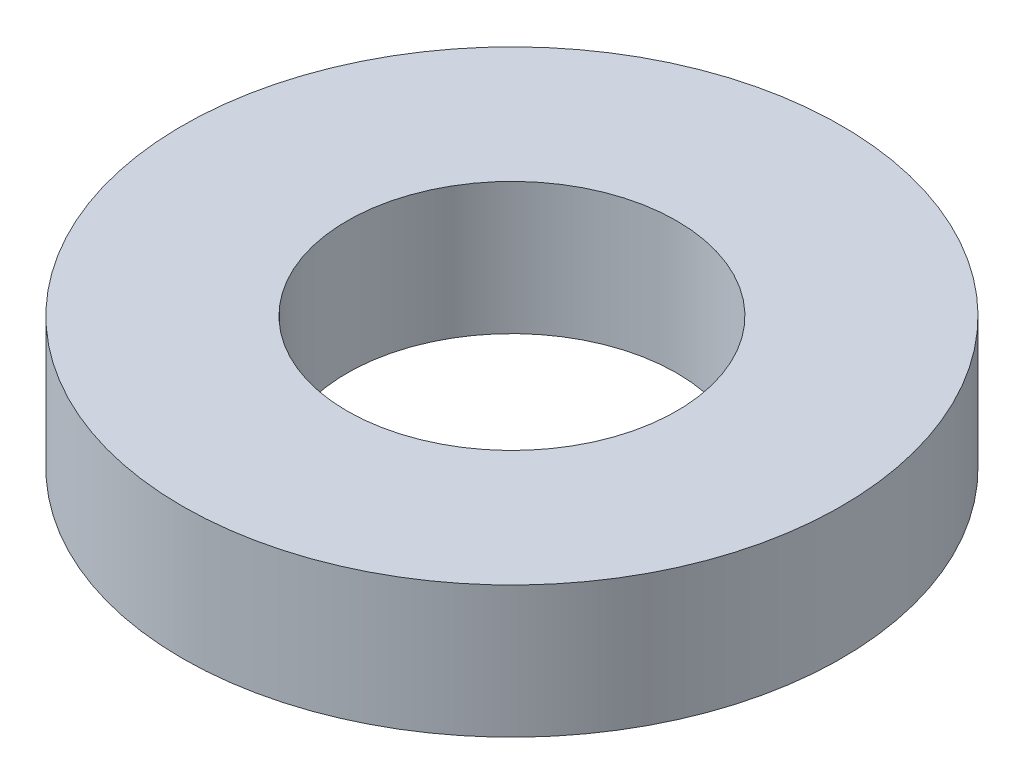
from build123d import *

# Parameters (mm, degrees)
SKETCH1_R           = 10
SKETCH1_R_2         = 5
BOSS_EXTRUDE1_DEPTH = 4


with BuildPart() as part:
    # Sketch1 → Boss-Extrude1 (new body)
    with BuildSketch(Plane(origin=(0, 0, 0), x_dir=(1, 0, 0), z_dir=(0, 1, 0))):
        with Locations(Location((0, 0, 0), (0, 0, 270))):
            Circle(SKETCH1_R)
        with Locations(Location((0, 0, 0), (0, 0, 270))):
            Circle(SKETCH1_R_2, mode=Mode.SUBTRACT)
    extrude(amount=BOSS_EXTRUDE1_DEPTH)


solid = part.part
